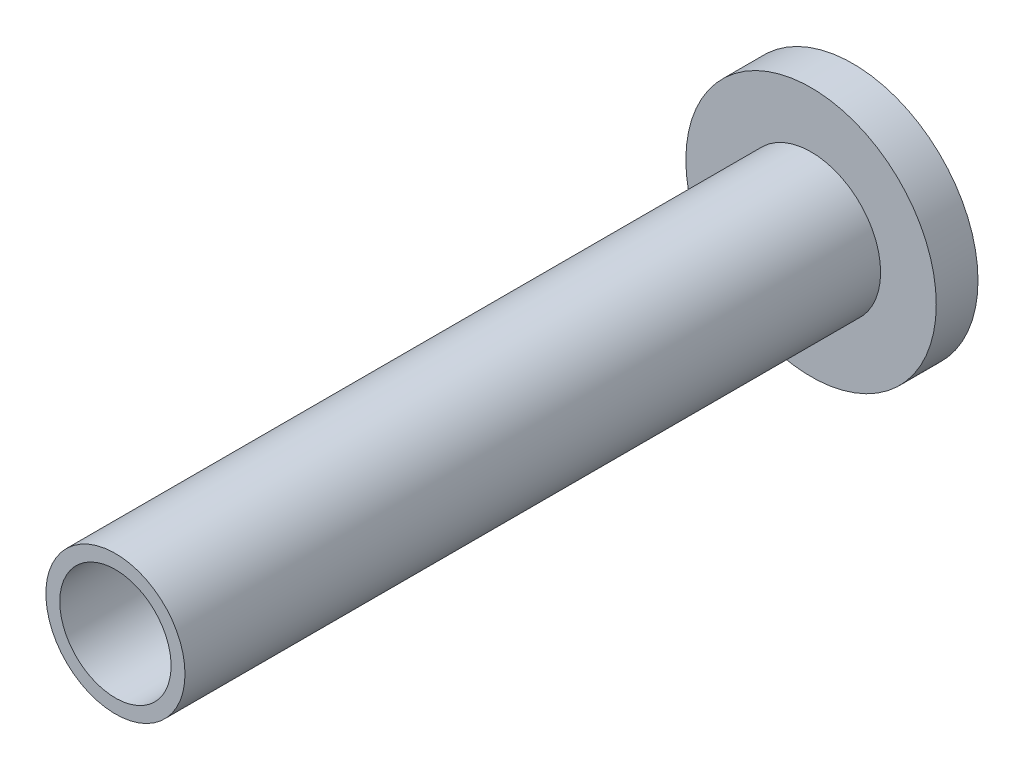
from build123d import *

# Parameters (mm, degrees)
ESQUISSE1_R                  = 2.5
BOSS_EXTRU_1_DEPTH           = 25
ESQUISSE2_R                  = 4.5
BOSS_EXTRU_2_DEPTH           = 1.5
ENL_V_MAT_EXTRU_1_DEPTH      = 28.25344015
ENL_V_MAT_EXTRU_1_DEPTH_BACK = 10
ESQUISSE3_R                  = 2


with BuildPart() as part:
    # Esquisse1 → Boss.-Extru.1 (new body)
    with BuildSketch(Plane.XY):
        Circle(ESQUISSE1_R)
    extrude(amount=BOSS_EXTRU_1_DEPTH)

    # Esquisse2 → Boss.-Extru.2 (add)
    with BuildSketch(Plane.XY):
        Circle(ESQUISSE2_R)
        Polygon((-1.718731116, -0.115769453), (-1.718731116, 0.115769453), (-0.115769453, 0.115769453), (-0.115769453, 1.718731116), (0.115769453, 1.718731116), (0.115769453, 0.115769453), (1.718731116, 0.115769453), (1.718731116, -0.115769453), (0.115769453, -0.115769453), (0.115769453, -1.718731116), (-0.115769453, -1.718731116), (-0.115769453, -0.115769453), align=None, mode=Mode.SUBTRACT)
    extrude(amount=-BOSS_EXTRU_2_DEPTH)

    # Esquisse3 → Enlèv. mat.-Extru.1 (cut, two sides: drawn at the far end of the back side and taken through both)
    with BuildSketch(Plane.XY.offset(25).offset(-ENL_V_MAT_EXTRU_1_DEPTH_BACK)):
        with Locations(Location((0, 0, 0), (0, 0, 180))):
            Circle(ESQUISSE3_R)
    extrude(amount=ENL_V_MAT_EXTRU_1_DEPTH + ENL_V_MAT_EXTRU_1_DEPTH_BACK, mode=Mode.SUBTRACT)


solid = part.part
